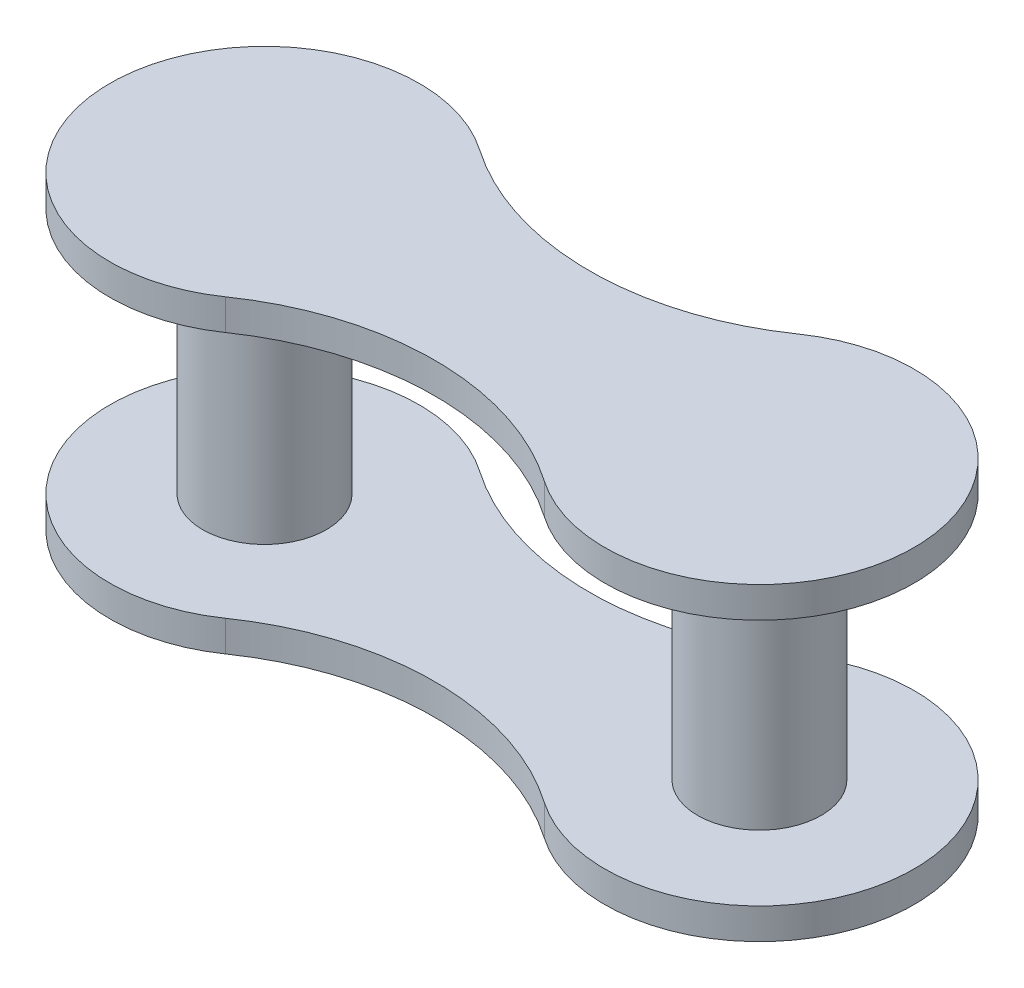
from build123d import *

# Parameters (mm, degrees)
BOSS_EXTRUDE1_DEPTH = 6.35
CUT_EXTRUDE1_START  = -5.715
SKETCH3_R           = 1.27
CUT_EXTRUDE1_DEPTH  = 5.08


with BuildPart() as part:
    # Sketch1 → Boss-Extrude1 (new body)
    with BuildSketch(Plane(origin=(0, 0, 0), x_dir=(1, 0, 0), z_dir=(0, 1, 0))):
        with BuildLine():
            ThreePointArc((-3.272170819, -2.610053381), (-2.267484875, -1.473222208), (-1.905, 0))
            ThreePointArc((-1.905, 0), (-2.267484875, 1.473222208), (-3.272170819, 2.610053381))
            ThreePointArc((-3.272170819, 2.610053381), (-8.255, 0), (-3.272170819, -2.610053381))
        make_face()
        with BuildLine():
            ThreePointArc((-3.272170819, 2.610053381), (-2.267484875, 1.473222208), (-1.905, 0))
            ThreePointArc((-1.905, 0), (-2.267484875, -1.473222208), (-3.272170819, -2.610053381))
            ThreePointArc((-3.272170819, -2.610053381), (0, -1.5875), (3.272170819, -2.610053381))
            ThreePointArc((3.272170819, -2.610053381), (1.905, 0), (3.272170819, 2.610053381))
            ThreePointArc((3.272170819, 2.610053381), (0, 1.5875), (-3.272170819, 2.610053381))
        make_face()
        with BuildLine():
            ThreePointArc((8.255, 0), (6.553222208, 2.812515125), (3.272170819, 2.610053381))
            ThreePointArc((3.272170819, 2.610053381), (1.905, 0), (3.272170819, -2.610053381))
            ThreePointArc((3.272170819, -2.610053381), (6.553222208, -2.812515125), (8.255, 0))
        make_face()
    extrude(amount=BOSS_EXTRUDE1_DEPTH)

    # Sketch3 → Cut-Extrude1 (cut)
    with BuildSketch(Plane(origin=(0, 6.35, 0), x_dir=(1, 0, 0), z_dir=(0, 1, 0)).offset(CUT_EXTRUDE1_START)):
        with BuildLine():
            ThreePointArc((3.272170819, 2.610053381), (0, 1.5875), (-3.272170819, 2.610053381))
            ThreePointArc((-3.272170819, 2.610053381), (-8.255, 0), (-3.272170819, -2.610053381))
            ThreePointArc((-3.272170819, -2.610053381), (0, -1.5875), (3.272170819, -2.610053381))
            ThreePointArc((3.272170819, -2.610053381), (8.255, 0), (3.272170819, 2.610053381))
        make_face()
        with Locations(Location((5.08, 0, 0), (0, 0, 270))):
            Circle(SKETCH3_R, mode=Mode.SUBTRACT)
        with Locations(Location((-5.08, 0, 0), (0, 0, 270))):
            Circle(SKETCH3_R, mode=Mode.SUBTRACT)
    extrude(amount=CUT_EXTRUDE1_DEPTH, mode=Mode.SUBTRACT)


solid = part.part
